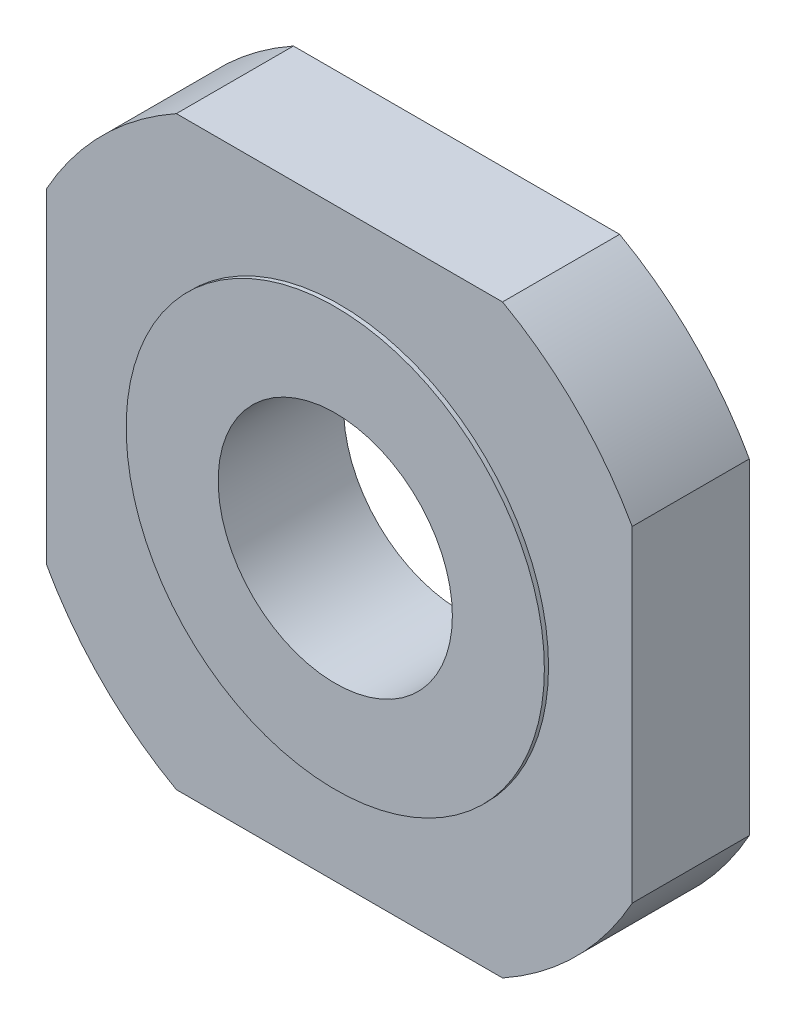
from build123d import *

# Parameters (mm, degrees)
SKETCH1_R           = 14
BOSS_EXTRUDE1_DEPTH = 7
SKETCH2_R           = 25
SKETCH2_R_2         = 14
BOSS_EXTRUDE2_DEPTH = 7.5


with BuildPart() as part:
    # Sketch1 → Boss-Extrude1 (new, symmetric)
    with BuildSketch(Plane.XY):
        with BuildLine():
            Line((-19.5, 35), (19.5, 35))
            ThreePointArc((19.5, 35), (28.332479027, 28.332479027), (35, 19.5))
            Line((35, 19.5), (35, -19.5))
            ThreePointArc((35, -19.5), (28.332479027, -28.332479027), (19.5, -35))
            Line((19.5, -35), (-19.5, -35))
            ThreePointArc((-19.5, -35), (-28.332479027, -28.332479027), (-35, -19.5))
            Line((-35, -19.5), (-35, 19.5))
            ThreePointArc((-35, 19.5), (-28.332479027, 28.332479027), (-19.5, 35))
        make_face()
        with Locations((-0.04820778, -0.04820778)):
            Circle(SKETCH1_R, mode=Mode.SUBTRACT)
    extrude(amount=BOSS_EXTRUDE1_DEPTH, both=True)

    # Sketch2 → Boss-Extrude2 (add, symmetric)
    with BuildSketch(Plane.XY):
        Circle(SKETCH2_R)
        Circle(SKETCH2_R_2, mode=Mode.SUBTRACT)
    extrude(amount=BOSS_EXTRUDE2_DEPTH, both=True)


solid = part.part
